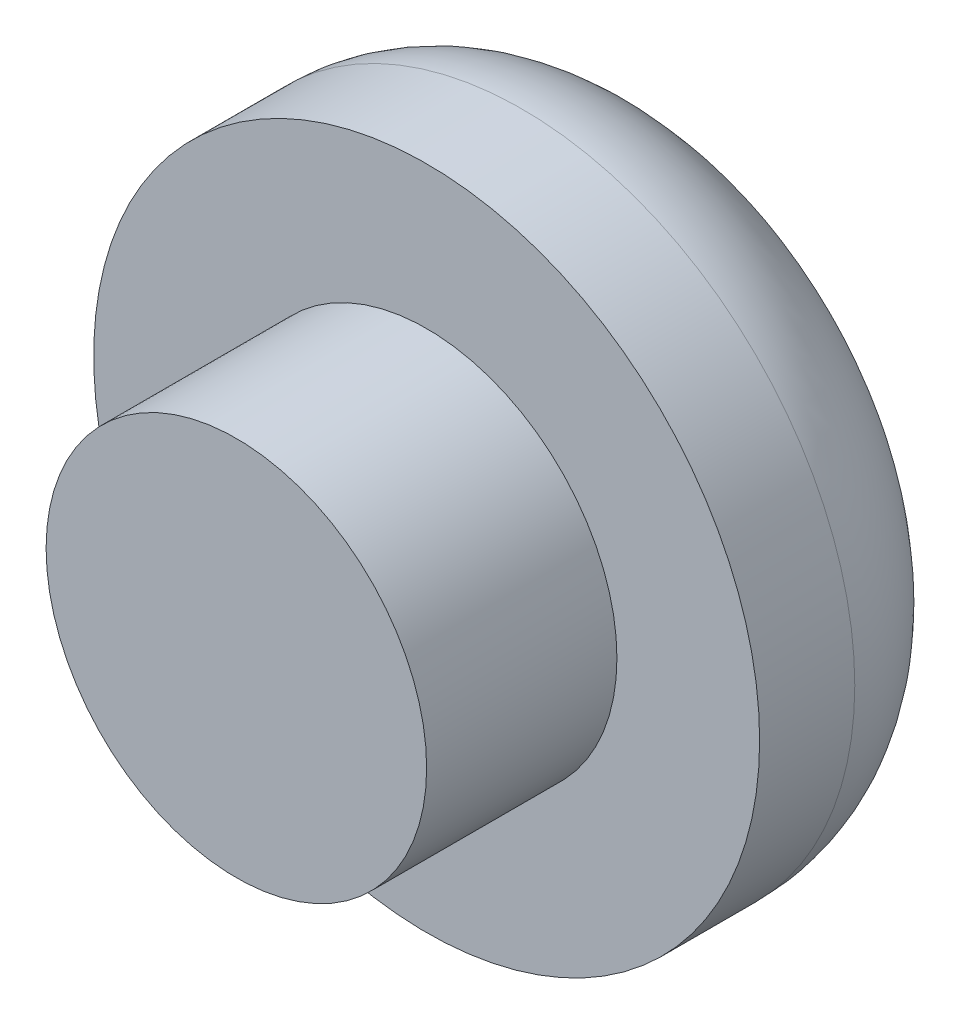
from build123d import *

# Parameters (mm, degrees)
ESQUISSE1_R          = 7
BASE_EXTRUSION_DEPTH = 5
CONG_1_R             = 3
ESQUISSE2_R          = 4
BOSS_EXTRU_2_DEPTH   = 4


with BuildPart() as part:
    # Esquisse1 → Base-Extrusion (new body)
    with BuildSketch(Plane.XY):
        Circle(ESQUISSE1_R)
    extrude(amount=BASE_EXTRUSION_DEPTH)

    # Congé1
    cong_1_edges = [part.edges().sort_by_distance(p)[0] for p in [
        (-7, 0, 0),
    ]]
    fillet(cong_1_edges, radius=CONG_1_R)

    # Esquisse2 → Boss.-Extru.2 (add)
    with BuildSketch(Plane.XY.offset(5)):
        Circle(ESQUISSE2_R)
    extrude(amount=BOSS_EXTRU_2_DEPTH)


solid = part.part
